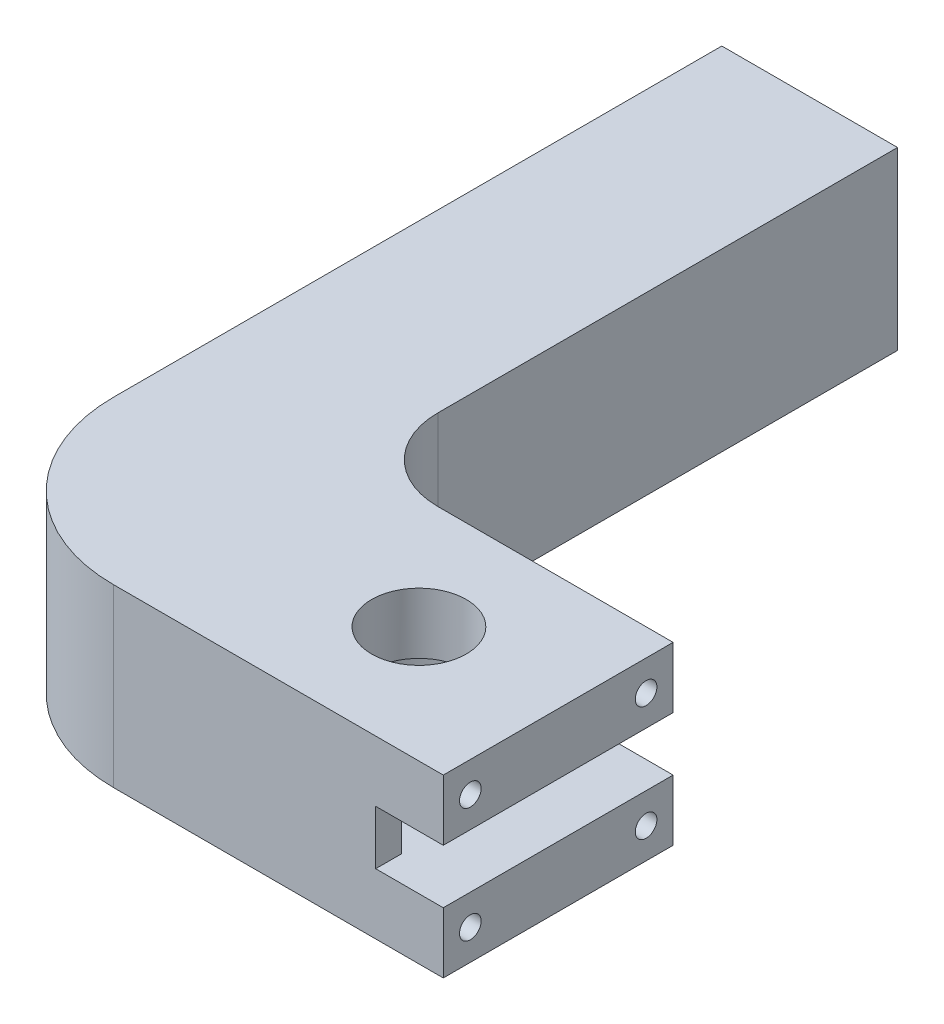
from build123d import *

# Parameters (mm, degrees)
SKETCH1_W           = 3987.8
SKETCH1_H           = 2159
BOSS_EXTRUDE1_DEPTH = 571.5
BOSS_EXTRUDE2_DEPTH = 508
SKETCH3_W           = 3987.8
SKETCH3_H           = 2159
BOSS_EXTRUDE3_DEPTH = 571.5
SKETCH4_W           = 685.8
SKETCH4_H           = 508
CUT_EXTRUDE1_DEPTH  = 12.7
SKETCH5_W           = 2159
SKETCH5_H           = 571.5
BOSS_EXTRUDE4_DEPTH = 635
SKETCH6_W           = 2159
SKETCH6_H           = 571.5
BOSS_EXTRUDE5_DEPTH = 635
SKETCH7_W           = 1651
SKETCH7_H           = 1651
BOSS_EXTRUDE6_DEPTH = 5080
HOLE1_D             = 203.2
HOLE1_DEPTH         = 508
HOLE2_D             = 889
HOLE2_DEPTH         = 571.5
HOLE3_D             = 889
FILLET1_R           = 762
FILLET2_R           = 1524


with BuildPart() as part:
    # Sketch1 → Boss-Extrude1 (new body)
    with BuildSketch(Plane(origin=(0, 571.5, 0), x_dir=(1, 0, 0), z_dir=(0, 1, 0))):
        with Locations((1993.9, -6159.5)):
            Rectangle(SKETCH1_W, SKETCH1_H)
    extrude(amount=-BOSS_EXTRUDE1_DEPTH)

    # Sketch2 → Boss-Extrude2 (add)
    with BuildSketch(Plane(origin=(0, 571.5, 0), x_dir=(-1, 0, 0), z_dir=(0, 1, 0))):
        with BuildLine():
            Line((-3987.8, 5321.3), (-3447.358143907, 5321.3))
            ThreePointArc((-3447.358143907, 5321.3), (-2466.981036143, 6073.844054389), (-3302, 6985))
            Line((-3302, 6985), (-3987.8, 6985))
            Line((-3987.8, 6985), (-3987.8, 7239))
            Line((-3987.8, 7239), (0, 7239))
            Line((0, 7239), (0, 5080))
            Line((0, 5080), (-3987.8, 5080))
            Line((-3987.8, 5080), (-3987.8, 5321.3))
        make_face()
    extrude(amount=BOSS_EXTRUDE2_DEPTH)

    # Sketch3 → Boss-Extrude3 (add)
    with BuildSketch(Plane(origin=(0, 1079.5, 0), x_dir=(-1, 0, 0), z_dir=(0, 1, 0))):
        with Locations((-1993.9, 6159.5)):
            Rectangle(SKETCH3_W, SKETCH3_H)
    extrude(amount=BOSS_EXTRUDE3_DEPTH)

    # Sketch4 → Cut-Extrude1 (cut)
    with BuildSketch(Plane(origin=(0, 0, 6985), x_dir=(-1, 0, 0), z_dir=(0, 0, -1))):
        with Locations((-3644.9, 825.5)):
            Rectangle(SKETCH4_W, SKETCH4_H)
    extrude(amount=-CUT_EXTRUDE1_DEPTH, mode=Mode.SUBTRACT)

    # Sketch5 → Boss-Extrude4 (add)
    with BuildSketch(Plane(origin=(3987.8, 0, 0), x_dir=(0, 0, -1), z_dir=(1, 0, 0))):
        with Locations((-6159.5, 285.75)):
            Rectangle(SKETCH5_W, SKETCH5_H)
    extrude(amount=BOSS_EXTRUDE4_DEPTH)

    # Sketch6 → Boss-Extrude5 (add)
    with BuildSketch(Plane(origin=(3987.8, 0, 0), x_dir=(0, 0, -1), z_dir=(1, 0, 0))):
        with Locations((-6159.5, 1365.25)):
            Rectangle(SKETCH6_W, SKETCH6_H)
    extrude(amount=BOSS_EXTRUDE5_DEPTH)

    # Sketch7 → Boss-Extrude6 (add)
    with BuildSketch(Plane(origin=(0, 0, 5080), x_dir=(-1, 0, 0), z_dir=(0, 0, -1))):
        with Locations((-825.5, 825.5)):
            Rectangle(SKETCH7_W, SKETCH7_H)
    extrude(amount=BOSS_EXTRUDE6_DEPTH)

    # Hole1
    with Locations(Plane(origin=(4622.8, 0, 0), x_dir=(0, 0, -1), z_dir=(1, 0, 0))):
        with Locations((-6985, 285.75), (-5334, 285.75), (-5334, 1365.25), (-6985, 1365.25)):
            Hole(HOLE1_D / 2, depth=HOLE1_DEPTH)

    # Hole2
    with Locations(Plane(origin=(0, 0, 0), x_dir=(-1, 0, 0), z_dir=(0, -1, 0))):
        with Locations((-3302, -6146.8)):
            Hole(HOLE2_D / 2, depth=HOLE2_DEPTH)

    # Hole3 (through all)
    with Locations(Plane(origin=(0, 1651, 0), x_dir=(1, 0, 0), z_dir=(0, 1, 0))):
        with Locations((3302, -6146.8)):
            Hole(HOLE3_D / 2)

    # Fillet1
    fillet1_edges = [part.edges().sort_by_distance(p)[0] for p in [
        (1651, 825.5, 5080),
    ]]
    fillet(fillet1_edges, radius=FILLET1_R)

    # Fillet2
    fillet2_edges = [part.edges().sort_by_distance(p)[0] for p in [
        (0, 825.5, 7239),
    ]]
    fillet(fillet2_edges, radius=FILLET2_R)


solid = part.part
